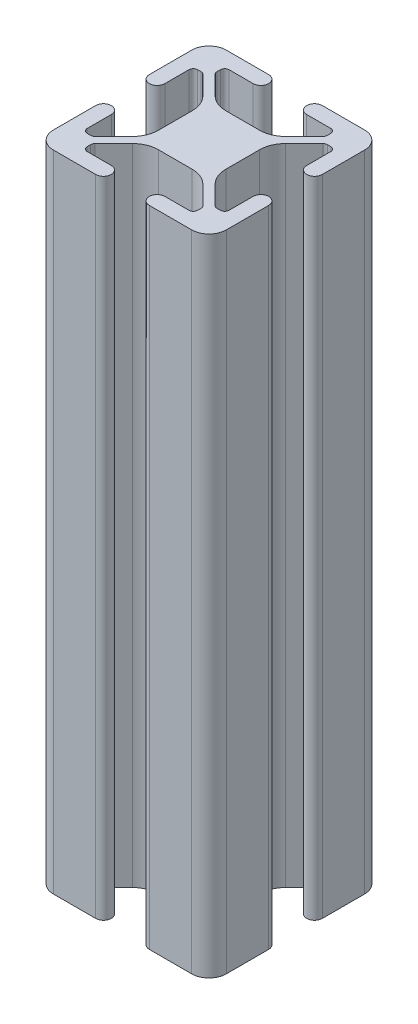
from build123d import *

# Parameters (mm, degrees)
EXTRUDE_1_DEPTH = 74.5


with BuildPart() as part:
    # 草图1 → 凸台-拉伸1 (new body)
    with BuildSketch(Plane(origin=(0, 0, 0), x_dir=(1, 0, 0), z_dir=(0, 1, 0))):
        with BuildLine():
            Line((-1.042752475, -10.085861632), (3.857247525, -10.085861632))
            ThreePointArc((3.857247525, -10.085861632), (4.757247525, -10.985861632), (3.857247525, -11.885861632))
            Line((3.857247525, -11.885861632), (1.076161722, -11.885861632))
            ThreePointArc((1.076161722, -11.885861632), (0.722608332, -12.032308241), (0.576161722, -12.385861632))
            Line((0.576161722, -12.385861632), (0.576161722, -12.790788968))
            ThreePointArc((0.576161722, -12.790788968), (0.614221956, -12.982130685), (0.722608332, -13.144342359))
            Line((0.722608332, -13.144342359), (2.885447948, -15.307181975))
            ThreePointArc((2.885447948, -15.307181975), (3.858717994, -15.957500229), (5.006768291, -16.185861632))
            Line((5.006768291, -16.185861632), (8.907726758, -16.185861632))
            ThreePointArc((8.907726758, -16.185861632), (10.055777055, -15.957500229), (11.029047102, -15.307181975))
            Line((11.029047102, -15.307181975), (13.191886718, -13.144342359))
            ThreePointArc((13.191886718, -13.144342359), (13.300273094, -12.982130685), (13.338333327, -12.790788968))
            Line((13.338333327, -12.790788968), (13.338333327, -12.385861632))
            ThreePointArc((13.338333327, -12.385861632), (13.191886718, -12.032308241), (12.838333327, -11.885861632))
            Line((12.838333327, -11.885861632), (10.057247525, -11.885861632))
            ThreePointArc((10.057247525, -11.885861632), (9.157247525, -10.985861632), (10.057247525, -10.085861632))
            Line((10.057247525, -10.085861632), (14.957247525, -10.085861632))
            ThreePointArc((14.957247525, -10.085861632), (16.371461087, -10.671648069), (16.957247525, -12.085861632))
            Line((16.957247525, -12.085861632), (16.957247525, -16.985861632))
            ThreePointArc((16.957247525, -16.985861632), (16.057247525, -17.885861632), (15.157247525, -16.985861632))
            Line((15.157247525, -16.985861632), (15.157247525, -14.204775829))
            ThreePointArc((15.157247525, -14.204775829), (15.010800915, -13.851222438), (14.657247525, -13.704775829))
            Line((14.657247525, -13.704775829), (14.252320188, -13.704775829))
            ThreePointArc((14.252320188, -13.704775829), (14.060978472, -13.742836063), (13.898766797, -13.851222438))
            Line((13.898766797, -13.851222438), (11.735927181, -16.014062054))
            ThreePointArc((11.735927181, -16.014062054), (11.085608927, -16.987332101), (10.857247525, -18.135382398))
            Line((10.857247525, -18.135382398), (10.857247525, -22.036340865))
            ThreePointArc((10.857247525, -22.036340865), (11.085608927, -23.184391162), (11.735927181, -24.157661209))
            Line((11.735927181, -24.157661209), (13.898766797, -26.320500825))
            ThreePointArc((13.898766797, -26.320500825), (14.060978472, -26.4288872), (14.252320188, -26.466947434))
            Line((14.252320188, -26.466947434), (14.657247525, -26.466947434))
            ThreePointArc((14.657247525, -26.466947434), (15.010800915, -26.320500825), (15.157247525, -25.966947434))
            Line((15.157247525, -25.966947434), (15.157247525, -23.185861632))
            ThreePointArc((15.157247525, -23.185861632), (16.057247525, -22.285861632), (16.957247525, -23.185861632))
            Line((16.957247525, -23.185861632), (16.957247525, -28.085861632))
            ThreePointArc((16.957247525, -28.085861632), (16.371461087, -29.500075194), (14.957247525, -30.085861632))
            Line((14.957247525, -30.085861632), (10.057247525, -30.085861632))
            ThreePointArc((10.057247525, -30.085861632), (9.157247525, -29.185861632), (10.057247525, -28.285861632))
            Line((10.057247525, -28.285861632), (12.838333327, -28.285861632))
            ThreePointArc((12.838333327, -28.285861632), (13.191886718, -28.139415022), (13.338333327, -27.785861632))
            Line((13.338333327, -27.785861632), (13.338333327, -27.380934295))
            ThreePointArc((13.338333327, -27.380934295), (13.300273094, -27.189592579), (13.191886718, -27.027380904))
            Line((13.191886718, -27.027380904), (11.029047102, -24.864541288))
            ThreePointArc((11.029047102, -24.864541288), (10.055777055, -24.214223034), (8.907726758, -23.985861632))
            Line((8.907726758, -23.985861632), (5.006768291, -23.985861632))
            ThreePointArc((5.006768291, -23.985861632), (3.858717994, -24.214223034), (2.885447948, -24.864541288))
            Line((2.885447948, -24.864541288), (0.722608332, -27.027380904))
            ThreePointArc((0.722608332, -27.027380904), (0.614221956, -27.189592579), (0.576161722, -27.380934295))
            Line((0.576161722, -27.380934295), (0.576161722, -27.785861632))
            ThreePointArc((0.576161722, -27.785861632), (0.722608332, -28.139415022), (1.076161722, -28.285861632))
            Line((1.076161722, -28.285861632), (3.857247525, -28.285861632))
            ThreePointArc((3.857247525, -28.285861632), (4.757247525, -29.185861632), (3.857247525, -30.085861632))
            Line((3.857247525, -30.085861632), (-1.042752475, -30.085861632))
            ThreePointArc((-1.042752475, -30.085861632), (-2.456966038, -29.500075194), (-3.042752475, -28.085861632))
            Line((-3.042752475, -28.085861632), (-3.042752475, -23.185861632))
            ThreePointArc((-3.042752475, -23.185861632), (-2.142752475, -22.285861632), (-1.242752475, -23.185861632))
            Line((-1.242752475, -23.185861632), (-1.242752475, -25.966947434))
            ThreePointArc((-1.242752475, -25.966947434), (-1.096305866, -26.320500825), (-0.742752475, -26.466947434))
            Line((-0.742752475, -26.466947434), (-0.337825138, -26.466947434))
            ThreePointArc((-0.337825138, -26.466947434), (-0.146483422, -26.4288872), (0.015728252, -26.320500825))
            Line((0.015728252, -26.320500825), (2.178567868, -24.157661209))
            ThreePointArc((2.178567868, -24.157661209), (2.828886122, -23.184391162), (3.057247525, -22.036340865))
            Line((3.057247525, -22.036340865), (3.057247525, -18.135382398))
            ThreePointArc((3.057247525, -18.135382398), (2.828886122, -16.987332101), (2.178567868, -16.014062054))
            Line((2.178567868, -16.014062054), (0.015728252, -13.851222438))
            ThreePointArc((0.015728252, -13.851222438), (-0.146483422, -13.742836063), (-0.337825138, -13.704775829))
            Line((-0.337825138, -13.704775829), (-0.742752475, -13.704775829))
            ThreePointArc((-0.742752475, -13.704775829), (-1.096305866, -13.851222438), (-1.242752475, -14.204775829))
            Line((-1.242752475, -14.204775829), (-1.242752475, -16.985861632))
            ThreePointArc((-1.242752475, -16.985861632), (-2.142752475, -17.885861632), (-3.042752475, -16.985861632))
            Line((-3.042752475, -16.985861632), (-3.042752475, -12.085861632))
            ThreePointArc((-3.042752475, -12.085861632), (-2.456966038, -10.671648069), (-1.042752475, -10.085861632))
        make_face()
    extrude(amount=EXTRUDE_1_DEPTH)


solid = part.part
